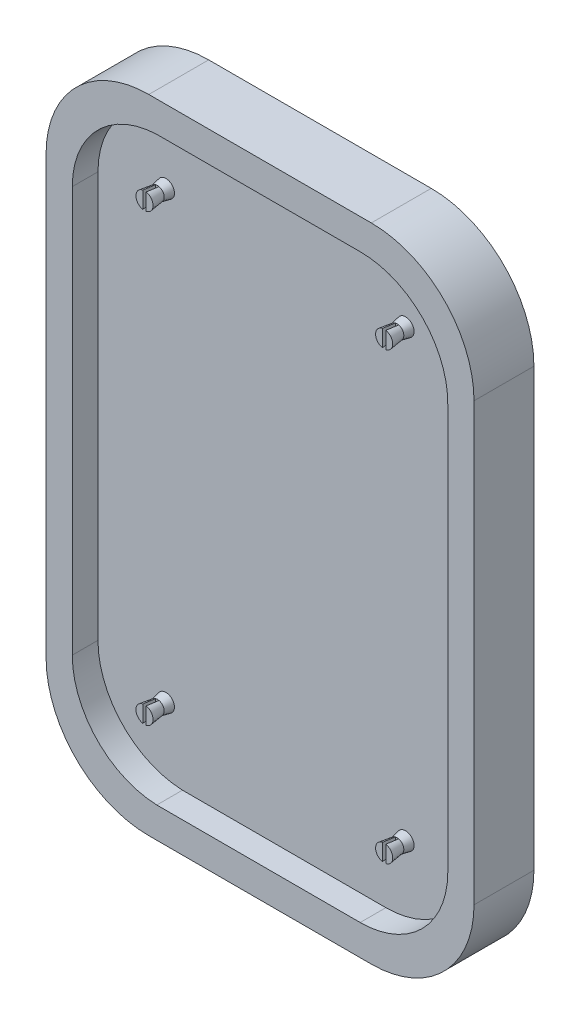
from build123d import *

# Parameters (mm, degrees)
SKETCH1_W                                = 63.5
SKETCH1_H                                = 95.25
BOSS_EXTRUDE1_DEPTH                      = 8.89
CUT_EXTRUDE1_DEPTH                       = 3.81
CUT_EXTRUDE2_DEPTH                       = 1.905
MIRROR2_AT_THE_SECOND_PLANE_COPY_1_DEPTH = 1.905
FILLET1_R                                = 15.24


with BuildPart() as part:
    # Sketch1 → Boss-Extrude1 (new body)
    with BuildSketch(Plane.XY):
        Rectangle(SKETCH1_W, SKETCH1_H)
    extrude(amount=-BOSS_EXTRUDE1_DEPTH)

    # Sketch4 → Cut-Extrude1 (cut)
    with BuildSketch(Plane.XY):
        with BuildLine():
            Line((-15.321546842, -43.089479105), (14.859998977, -43.1))
            ThreePointArc((14.859998977, -43.1), (24.052387544, -39.292388268), (27.86, -30.1))
            Line((27.86, -30.1), (27.86, 29.848016994))
            ThreePointArc((27.86, 29.848016994), (24.142757308, 39.204832311), (14.858601027, 43.099999609))
            Line((14.858601027, 43.099999609), (-15.322946088, 43.094305911))
            ThreePointArc((-15.322946088, 43.094305911), (-24.214524383, 39.131012084), (-27.86, 30.104475598))
            Line((-27.86, 30.104475598), (-27.86, -30.1))
            ThreePointArc((-27.86, -30.1), (-24.214594541, -39.127455295), (-15.321546842, -43.089479105))
        make_face()
    extrude(amount=-CUT_EXTRUDE1_DEPTH, mode=Mode.SUBTRACT)

    # Sketch8 → Revolve1 (revolve)
    with BuildSketch(Plane.ZX.offset(33.02)):
        Polygon((-3.81, -17.78), (-2.921, -17.78), (-0.635, -17.78), (-0.635, -16.51), (-2.54, -16.764), (-3.81, -16.51), align=None)
    revolve1 = revolve(axis=Axis((-17.78, 33.02, -3.81), (0, 0, 1)))

    # Sketch9 → Revolve2 (revolve)
    with BuildSketch(Plane.ZX.offset(33.02)):
        Polygon((-3.81, 17.78), (-2.54, 17.78), (-0.635, 17.78), (-0.635, 19.05), (-2.54, 18.796), (-3.81, 19.05), align=None)
    revolve2 = revolve(axis=Axis((17.78, 33.02, -3.81), (0, 0, 1)))

    # Mirror1: Revolve1, Revolve2 across plane
    add(revolve1.mirror(Plane.ZX))
    add(revolve2.mirror(Plane.ZX))

    # Sketch10 → Cut-Extrude2 (cut)
    with BuildSketch(Plane.XY.offset(-0.635)):
        with BuildLine():
            Line((-17.53, 31.774849407), (-17.53, 34.265150593))
            ThreePointArc((-17.53, 34.265150593), (-17.78, 34.29), (-18.03, 34.265150593))
            Line((-18.03, 34.265150593), (-18.03, 31.774849407))
            ThreePointArc((-18.03, 31.774849407), (-17.78, 31.75), (-17.53, 31.774849407))
        make_face()
    cut_extrude2 = extrude(amount=-CUT_EXTRUDE2_DEPTH, mode=Mode.SUBTRACT)

    # Mirror2: Cut-Extrude2 across plane
    add(cut_extrude2.mirror(Plane.ZX), mode=Mode.SUBTRACT)

    # Mirror2 at the second plane: Cut-Extrude2 across plane
    add(cut_extrude2.mirror(Plane(origin=(0, 0, 0), x_dir=(0, 0, 1), z_dir=(1, 0, 0))), mode=Mode.SUBTRACT)

    # Mirror2 at the second plane copy 1 sketc → Mirror2 at the second plane copy 1 (cut)
    with BuildSketch(Plane(origin=(0, 0, -0.635), x_dir=(-1, 0, 0), z_dir=(0, 0, 1))):
        with BuildLine():
            Line((-17.53, 31.774849407), (-17.53, 34.265150593))
            ThreePointArc((-17.53, 34.265150593), (-17.78, 34.29), (-18.03, 34.265150593))
            Line((-18.03, 34.265150593), (-18.03, 31.774849407))
            ThreePointArc((-18.03, 31.774849407), (-17.78, 31.75), (-17.53, 31.774849407))
        make_face()
    extrude(amount=-MIRROR2_AT_THE_SECOND_PLANE_COPY_1_DEPTH, mode=Mode.SUBTRACT)

    # Fillet1
    fillet1_edges = [part.edges().sort_by_distance(p)[0] for p in [
        (31.75, -47.625, -4.445),
        (-31.75, -47.625, -4.445),
        (31.75, 47.625, -4.445),
        (-31.75, 47.625, -4.445),
    ]]
    fillet(fillet1_edges, radius=FILLET1_R)


solid = part.part
